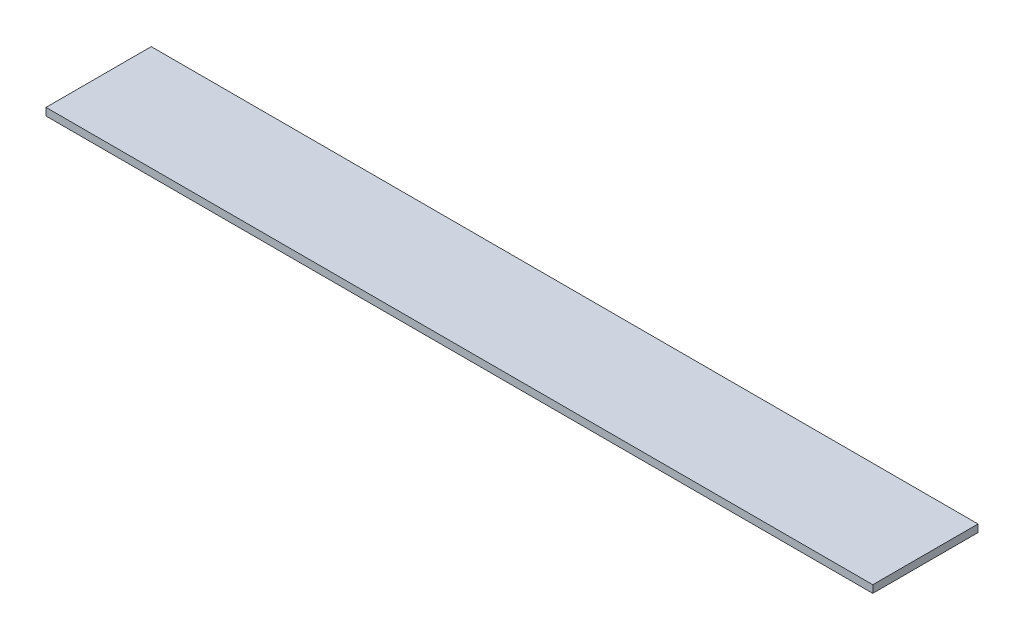
from build123d import *

# Parameters (mm, degrees)
SKETCH1_W           = 1397
SKETCH1_H           = 177.8
BOSS_EXTRUDE1_DEPTH = 12.7


with BuildPart() as part:
    # Sketch1 → Boss-Extrude1 (new body)
    with BuildSketch(Plane(origin=(0, 0, 0), x_dir=(1, 0, 0), z_dir=(0, 1, 0))):
        Rectangle(SKETCH1_W, SKETCH1_H)
    extrude(amount=BOSS_EXTRUDE1_DEPTH)


solid = part.part
